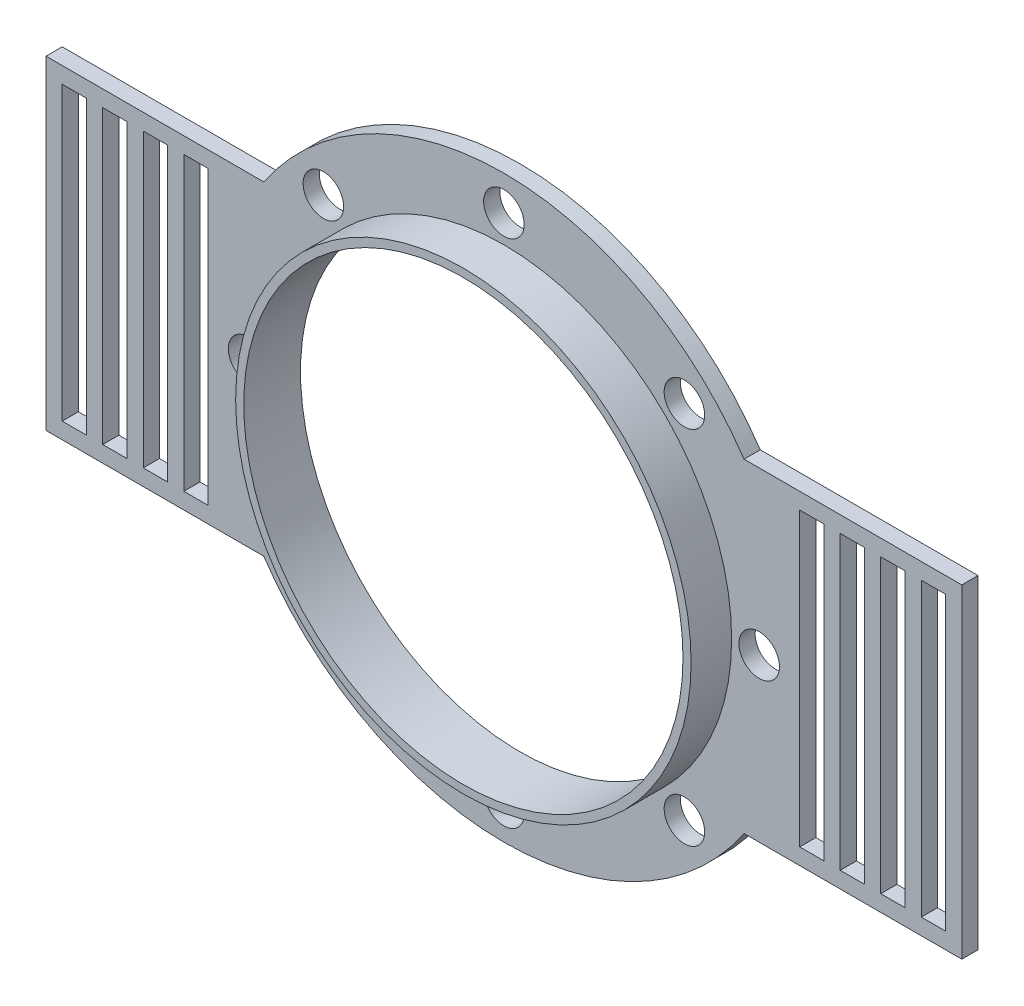
from build123d import *

# Parameters (mm, degrees)
CROQUIS1_R              = 27.1
CROQUIS1_R_2            = 2.5
CROQUIS1_W              = 3
CROQUIS1_H              = 36
SALIENTE_EXTRUIR1_DEPTH = 2
CROQUIS2_R              = 28.1
CROQUIS2_R_2            = 27.1
SALIENTE_EXTRUIR2_DEPTH = 5


with BuildPart() as part:
    # Croquis1 → Saliente-Extruir1 (new body)
    with BuildSketch(Plane.XY):
        with BuildLine():
            Line((-56.5, 20), (-29.632119398, 20))
            ThreePointArc((-29.632119398, 20), (0, 35.75), (29.632119398, 20))
            Line((29.632119398, 20), (56.5, 20))
            Line((56.5, 20), (56.5, -20))
            Line((56.5, -20), (29.632119398, -20))
            ThreePointArc((29.632119398, -20), (0, -35.75), (-29.632119398, -20))
            Line((-29.632119398, -20), (-56.5, -20))
            Line((-56.5, -20), (-56.5, 20))
        make_face()
        Circle(CROQUIS1_R, mode=Mode.SUBTRACT)
        with Locations((31.5, 0)):
            Circle(CROQUIS1_R_2, mode=Mode.SUBTRACT)
        with Locations((22.273863607, -22.273863607)):
            Circle(CROQUIS1_R_2, mode=Mode.SUBTRACT)
        with Locations((0, -31.5)):
            Circle(CROQUIS1_R_2, mode=Mode.SUBTRACT)
        with Locations((-22.273863607, -22.273863607)):
            Circle(CROQUIS1_R_2, mode=Mode.SUBTRACT)
        with Locations((-31.5, 0)):
            Circle(CROQUIS1_R_2, mode=Mode.SUBTRACT)
        with Locations((-22.273863607, 22.273863607)):
            Circle(CROQUIS1_R_2, mode=Mode.SUBTRACT)
        with Locations((0, 31.5)):
            Circle(CROQUIS1_R_2, mode=Mode.SUBTRACT)
        with Locations((22.273863607, 22.273863607)):
            Circle(CROQUIS1_R_2, mode=Mode.SUBTRACT)
        with Locations((-48, 0)):
            Rectangle(CROQUIS1_W, CROQUIS1_H, mode=Mode.SUBTRACT)
        with Locations((-53, 0)):
            Rectangle(CROQUIS1_W, CROQUIS1_H, mode=Mode.SUBTRACT)
        with Locations((-43, 0)):
            Rectangle(CROQUIS1_W, CROQUIS1_H, mode=Mode.SUBTRACT)
        with Locations((-38, 0)):
            Rectangle(CROQUIS1_W, CROQUIS1_H, mode=Mode.SUBTRACT)
        with Locations((38, 0)):
            Rectangle(CROQUIS1_W, CROQUIS1_H, mode=Mode.SUBTRACT)
        with Locations((43, 0)):
            Rectangle(CROQUIS1_W, CROQUIS1_H, mode=Mode.SUBTRACT)
        with Locations((48, 0)):
            Rectangle(CROQUIS1_W, CROQUIS1_H, mode=Mode.SUBTRACT)
        with Locations((53, 0)):
            Rectangle(CROQUIS1_W, CROQUIS1_H, mode=Mode.SUBTRACT)
    extrude(amount=SALIENTE_EXTRUIR1_DEPTH)

    # Croquis2 → Saliente-Extruir2 (add)
    with BuildSketch(Plane.XY.offset(2)):
        Circle(CROQUIS2_R)
        Circle(CROQUIS2_R_2, mode=Mode.SUBTRACT)
    extrude(amount=SALIENTE_EXTRUIR2_DEPTH)


solid = part.part
